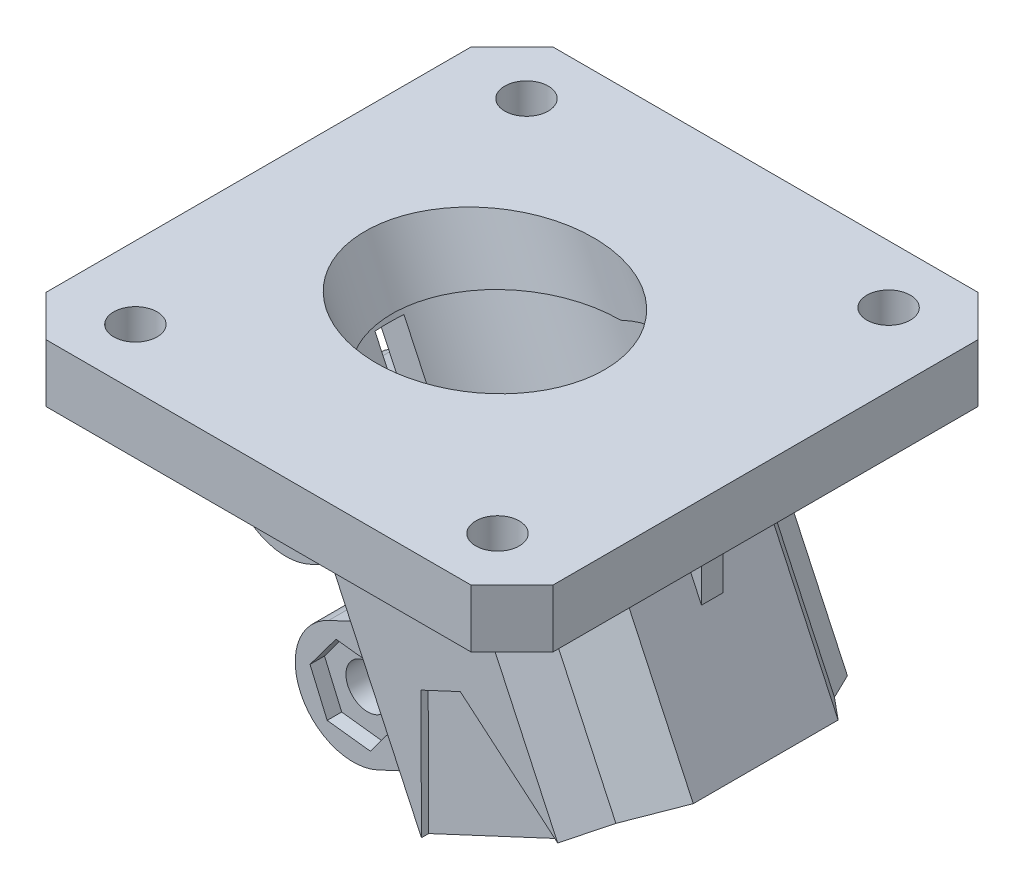
from build123d import *

# Parameters (mm, degrees)
BOSS_EXTRUDE1_DEPTH            = 4
SKETCH2_R                      = 1.5
CUT_EXTRUDE1_DEPTH             = 26.069902273
BOSS_EXTRUDE2_REACH            = 56.739
SKETCH4_R                      = 8
SKETCH5_R                      = 8
CUT_EXTRUDE2_DEPTH             = 20
BOSS_EXTRUDE3_DEPTH            = 0.75
BOSS_EXTRUDE3_DEPTH_BACK       = 0.75
SKETCH8_R                      = 1.5
BOSS_EXTRUDE4_DEPTH            = 4
BOSS_EXTRUDE5_START            = 5
SKETCH9_R                      = 1.5
BOSS_EXTRUDE5_DEPTH            = 5
CUT_EXTRUDE3_REACH             = 39.025
CUT_EXTRUDE3_END_RADIUS        = 8
SKETCH10_W                     = 2
SKETCH10_H                     = 23
CUT_EXTRUDE3_DIRECTION_2_DEPTH = 38.025134912
CUT_EXTRUDE4_DEPTH             = 0.5
CUT_EXTRUDE5_DEPTH             = 40.98829237
CUT_EXTRUDE5_DEPTH_BACK        = 0.5
SKETCH13_R                     = 7.5
CUT_EXTRUDE6_DEPTH             = 34.897839558
SKETCH14_R                     = 1.5
CUT_EXTRUDE7_DEPTH             = 1


with BuildPart() as part:
    # Sketch1 → Boss-Extrude1 (new body)
    with BuildSketch(Plane(origin=(0, 0, 0), x_dir=(1, 0, 0), z_dir=(0, 1, 0))):
        Polygon((-17.5, 14.671572875), (-14.671572875, 17.5), (14.671572875, 17.5), (17.5, 14.671572875), (17.5, -14.671572875), (14.671572875, -17.5), (-14.671572875, -17.5), (-17.5, -14.671572875), align=None)
    extrude(amount=BOSS_EXTRUDE1_DEPTH)

    # Sketch2 → Cut-Extrude1 (cut, through all)
    with BuildSketch(Plane(origin=(0, 4, 0), x_dir=(1, 0, 0), z_dir=(0, 1, 0))):
        with Locations((-12.5, 13.5)):
            Circle(SKETCH2_R)
        with Locations((12.5, 13.5)):
            Circle(SKETCH2_R)
        with Locations((-12.5, -13.5)):
            Circle(SKETCH2_R)
        with Locations((12.5, -13.5)):
            Circle(SKETCH2_R)
    extrude(amount=-CUT_EXTRUDE1_DEPTH, mode=Mode.SUBTRACT)

    # Boss-Extrude2: up to this plane
    boss_extrude2_end = Plane(origin=(0, 0, 0), z_dir=(0, 1, 0))
    # Sketch4 → Boss-Extrude2 (add, up to the surface)
    with BuildSketch(Plane(origin=(8.452365235, -18.126155741, 0), x_dir=(-0.906307787036651, -0.42261826174069733, 0), z_dir=(0.4226182617406973, -0.9063077870366509, 0)), mode=Mode.PRIVATE) as boss_extrude2_sk1:
        Polygon((10, 5), (10, -5), (6.91357525, -7.544402143), (5.190195094, -10), (-5.190195094, -10), (-6.91357525, -7.544402143), (-10, -5), (-10, 5), (-6.91357525, 7.544402143), (-5.190195094, 10), (5.190195094, 10), (6.91357525, 7.544402143), align=None)
        Circle(SKETCH4_R, mode=Mode.SUBTRACT)
    boss_extrude2_tool1 = split(extrude(boss_extrude2_sk1.sketch, amount=-BOSS_EXTRUDE2_REACH, mode=Mode.PRIVATE), bisect_by=boss_extrude2_end, keep=Keep.BOTH, mode=Mode.PRIVATE)
    add(boss_extrude2_tool1.solids().sort_by_distance((-0.35437, -22.232804, 0))[0])

    # Sketch5 → Cut-Extrude2 (cut)
    with BuildSketch(Plane(origin=(8.452365235, -18.126155741, 0), x_dir=(-0.906307787036651, -0.42261826174069733, 0), z_dir=(0.4226182617406973, -0.9063077870366509, 0))):
        Circle(SKETCH5_R)
    extrude(amount=-CUT_EXTRUDE2_DEPTH, mode=Mode.SUBTRACT)

    # Sketch7 → Boss-Extrude3 (add, two sides: drawn at the far end of the back side and taken through both)
    with BuildSketch(Plane.XY.offset(-BOSS_EXTRUDE3_DEPTH_BACK)):
        Polygon((11.03377919, 0), (13.831625139, -6), (13.831625139, 0), align=None)
    extrude(amount=BOSS_EXTRUDE3_DEPTH + BOSS_EXTRUDE3_DEPTH_BACK)

    # Sketch8 → Boss-Extrude4 (add)
    # profile 1 of 2: a face of its own
    with BuildSketch(Plane.XY):
        with BuildLine():
            Line((-4.271887002, -14.500924593), (-7.443964256, -15.980088509))
            ThreePointArc((-7.443964256, -15.980088509), (-9.136877595, -20.631329679), (-4.485636424, -22.324243018))
            Line((-4.485636424, -22.324243018), (-1.31355917, -20.845079102))
            Line((-1.31355917, -20.845079102), (-4.271887002, -14.500924593))
        make_face()
        with Locations((-5.96480034, -19.152165763)):
            Circle(SKETCH8_R, mode=Mode.SUBTRACT)
    # profile 2 of 2: a face of its own
    with BuildSketch(Plane.XY):
        with BuildLine():
            Line((-9.134437303, -12.354857361), (-5.962360049, -10.875693444))
            Line((-5.962360049, -10.875693444), (-8.920687881, -4.531538935))
            Line((-8.920687881, -4.531538935), (-12.092765136, -6.010702851))
            ThreePointArc((-12.092765136, -6.010702851), (-13.785678474, -10.661944022), (-9.134437303, -12.354857361))
        make_face()
        with Locations((-10.613601219, -9.182780106)):
            Circle(SKETCH8_R, mode=Mode.SUBTRACT)
    extrude(amount=-BOSS_EXTRUDE4_DEPTH)

    # Sketch9 → Boss-Extrude5 (add)
    # profile 1 of 2: a face of its own
    with BuildSketch(Plane.XY.offset(BOSS_EXTRUDE5_START)):
        with BuildLine():
            Line((-12.371097281, -5.589563219), (-9.159758839, -4.01884961))
            Line((-9.159758839, -4.01884961), (-5.751050918, -11.328847338))
            Line((-5.751050918, -11.328847338), (-8.923128172, -12.808011254))
            ThreePointArc((-8.923128172, -12.808011254), (-14.22298081, -10.906838971), (-12.371097281, -5.589563219))
        make_face()
        with Locations((-10.613601219, -9.182780106)):
            Circle(SKETCH9_R, mode=Mode.SUBTRACT)
    # profile 2 of 2: a face of its own
    with BuildSketch(Plane.XY.offset(BOSS_EXTRUDE5_START)):
        with BuildLine():
            Line((-7.655273387, -15.526934615), (-4.483196133, -14.047770699))
            Line((-4.483196133, -14.047770699), (-1.102250039, -21.298232995))
            Line((-1.102250039, -21.298232995), (-4.274327293, -22.777396911))
            ThreePointArc((-4.274327293, -22.777396911), (-9.590031488, -20.84263881), (-7.655273387, -15.526934615))
        make_face()
        with Locations((-5.96480034, -19.152165763)):
            Circle(SKETCH9_R, mode=Mode.SUBTRACT)
    extrude(amount=-BOSS_EXTRUDE5_DEPTH)

    # Cut-Extrude3: up to this cylinder (the profile starts outside it)
    cut_extrude3_end = Plane(origin=(3.592255235, -7.703616212, 0), z_dir=(0.4226182617406974, -0.906307787036651, 0)) * Cylinder(CUT_EXTRUDE3_END_RADIUS, 95.05, mode=Mode.PRIVATE)
    # Sketch10 → Cut-Extrude3 (cut, up to the surface)
    with BuildSketch(Plane(origin=(-9.06307787, -4.226182617, 0), x_dir=(0, 0, 1), z_dir=(-0.9063077870366509, -0.42261826174069744, 0)), mode=Mode.PRIVATE) as cut_extrude3_sk1:
        with Locations((0, -8.5)):
            Rectangle(SKETCH10_W, SKETCH10_H)
    cut_extrude3_tool1 = extrude(cut_extrude3_sk1.sketch, amount=-CUT_EXTRUDE3_REACH, mode=Mode.PRIVATE) - cut_extrude3_end
    add(cut_extrude3_tool1.solids().sort_by_distance((-5.470823, -11.929799, 0))[0], mode=Mode.SUBTRACT)

    # Sketch10 → Cut-Extrude3 direction 2 (cut)
    with BuildSketch(Plane(origin=(-9.06307787, -4.226182617, 0), x_dir=(0, 0, 1), z_dir=(-0.9063077870366509, -0.42261826174069744, 0))):
        with Locations((0, -8.5)):
            Rectangle(SKETCH10_W, SKETCH10_H)
    extrude(amount=CUT_EXTRUDE3_DIRECTION_2_DEPTH, mode=Mode.SUBTRACT)

    # Sketch11 → Cut-Extrude4 (cut)
    with BuildSketch(Plane.XY.offset(10)):
        Polygon((3.748451005, -20.319626969), (3.71195746, -11.509620837), (6.430880821, -10.241766052), (13.156279465, -15.932684512), align=None)
    extrude(amount=-CUT_EXTRUDE4_DEPTH, mode=Mode.SUBTRACT)

    # Sketch12 → Cut-Extrude5 (cut, two sides: drawn at the far end of the back side and taken through both)
    with BuildSketch(Plane(origin=(0, 0, -10), x_dir=(-1, 0, 0), z_dir=(0, 0, -1)).offset(-CUT_EXTRUDE5_DEPTH_BACK)):
        Polygon((-76.618175431, -69.633066368), (-13.156279465, -15.932684512), (-6.430880821, -10.241766052), (-3.71195746, -11.509620837), (-3.748451005, -20.319626969), (-4.092809705, -103.452199816), (-74.3600994, -254.140888852), (-146.885465125, -220.321755404), align=None)
    extrude(amount=CUT_EXTRUDE5_DEPTH + CUT_EXTRUDE5_DEPTH_BACK, mode=Mode.SUBTRACT)

    # Sketch13 → Cut-Extrude6 (cut, through all)
    with BuildSketch(Plane(origin=(0, 0, 0), x_dir=(0.9063077870366509, 0.4226182617406975, 0), z_dir=(0.4226182617406975, -0.9063077870366509, 0))):
        Circle(SKETCH13_R)
    extrude(amount=-CUT_EXTRUDE6_DEPTH, mode=Mode.SUBTRACT)

    # Sketch14 → Cut-Extrude7 (cut)
    # profile 1 of 2: a face of its own
    with BuildSketch(Plane.XY.offset(5)):
        Polygon((-12.363797533, -11.594558579), (-9.380056654, -11.906472615), (-7.618060736, -9.478434233), (-8.839805697, -6.738481815), (-11.823546576, -6.42656778), (-13.585542494, -8.854606161), align=None)
        with Locations((-10.613601219, -9.182780106)):
            Circle(SKETCH14_R, mode=Mode.SUBTRACT)
    # profile 2 of 2: a face of its own
    with BuildSketch(Plane.XY.offset(5)):
        Polygon((-7.758410921, -21.556944565), (-4.779006098, -21.907867491), (-2.985395517, -19.50308869), (-4.17118976, -16.747386962), (-7.150594583, -16.396464035), (-8.944205163, -18.801242837), align=None)
    extrude(amount=-CUT_EXTRUDE7_DEPTH, mode=Mode.SUBTRACT)


solid = part.part
